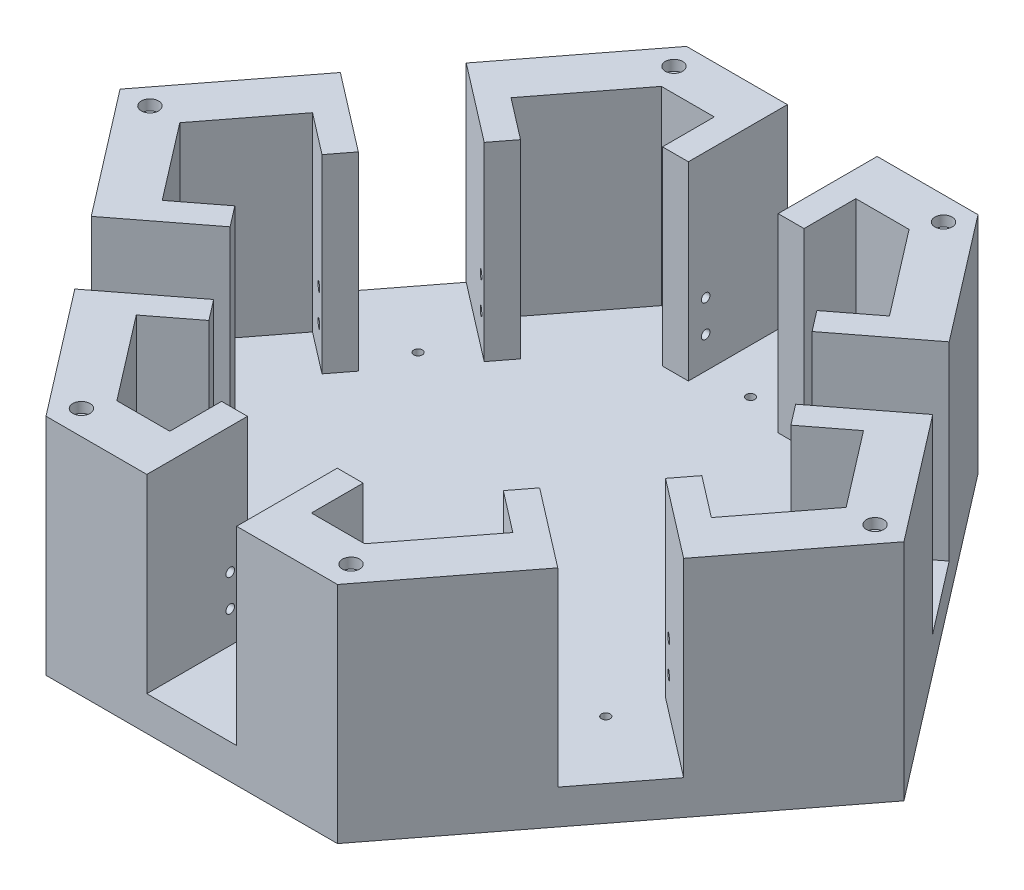
from build123d import *

# Parameters (mm, degrees)
BOSS_EXTRUDE2_DEPTH = 65
CUT_EXTRUDE1_DEPTH  = 55
SKETCH4_W           = 26
SKETCH4_H           = 55
CUT_EXTRUDE2_DEPTH  = 17
SKETCH10_W          = 26
SKETCH10_H          = 55
CUT_EXTRUDE3_DEPTH  = 17
SKETCH9_W           = 26
SKETCH9_H           = 55
CUT_EXTRUDE4_DEPTH  = 17
SKETCH8_W           = 26
SKETCH8_H           = 55
CUT_EXTRUDE5_DEPTH  = 17
SKETCH7_W           = 26
SKETCH7_H           = 55
CUT_EXTRUDE6_DEPTH  = 17
SKETCH6_W           = 26
SKETCH6_H           = 55
CUT_EXTRUDE7_DEPTH  = 17
SKETCH11_W          = 7.5
SKETCH11_H          = 15
BOSS_EXTRUDE4_DEPTH = 55
SKETCH12_R          = 1.25
CUT_EXTRUDE8_DEPTH  = 17
SKETCH13_R          = 1.25
CUT_EXTRUDE9_DEPTH  = 11
CUT_EXTRUDE10_START = -11
SKETCH14_R          = 1.25
CUT_EXTRUDE10_DEPTH = 11
SKETCH15_R          = 1.25
CUT_EXTRUDE11_DEPTH = 43
SKETCH16_R          = 1.25
CUT_EXTRUDE12_DEPTH = 43
SKETCH17_R          = 1.25
CUT_EXTRUDE13_DEPTH = 43
SKETCH18_R          = 1.25
CUT_EXTRUDE14_DEPTH = 43
SKETCH19_R          = 1.25
CUT_EXTRUDE15_DEPTH = 43
SKETCH20_R          = 2.5
CUT_EXTRUDE16_DEPTH = 3


with BuildPart() as part:
    # Sketch1 → Boss-Extrude2 (new body)
    with BuildSketch(Plane(origin=(0, 0, 0), x_dir=(1, 0, 0), z_dir=(0, 1, 0))):
        Polygon((-42.489685364, -94.349995431), (41.923987132, -94.349995431), (113.2396696, -1.586008434), (41.923987132, 91.177978564), (-42.489685364, 91.177978564), (-113.805367831, -1.586008434), align=None)
    extrude(amount=BOSS_EXTRUDE2_DEPTH)

    # Sketch5 → Cut-Extrude1 (cut)
    with BuildSketch(Plane(origin=(0, 65, 0), x_dir=(1, 0, 0), z_dir=(0, 1, 0))):
        Polygon((-96.734562657, -1.348107169), (-36.116232559, 77.501281779), (35.635389063, 77.501281779), (96.25371916, -1.348107169), (35.635389063, -80.197496117), (-36.116232559, -80.197496117), align=None)
    extrude(amount=-CUT_EXTRUDE1_DEPTH, mode=Mode.SUBTRACT)

    # Sketch4 → Cut-Extrude2 (cut)
    with BuildSketch(Plane(origin=(-70.762900796, 0, -54.40154878), x_dir=(-0.6094893586708845, 0, 0.792794249264558), z_dir=(-0.7927942492645579, 0, -0.6094893586708844))):
        with Locations((12.116086518, 37.5)):
            Rectangle(SKETCH4_W, SKETCH4_H)
    extrude(amount=-CUT_EXTRUDE2_DEPTH, mode=Mode.SUBTRACT)

    # Sketch10 → Cut-Extrude3 (cut)
    with BuildSketch(Plane(origin=(-72.295618263, 0, 55.579880973), x_dir=(0.6094893586708846, 0, 0.7927942492645578), z_dir=(-0.7927942492645578, 0, 0.6094893586708846))):
        with Locations((-9.601329787, 37.5)):
            Rectangle(SKETCH10_W, SKETCH10_H)
    extrude(amount=-CUT_EXTRUDE3_DEPTH, mode=Mode.SUBTRACT)

    # Sketch9 → Cut-Extrude4 (cut)
    with BuildSketch(Plane.XY.offset(94.349995431)):
        with Locations((-0.282849116, 37.5)):
            Rectangle(SKETCH9_W, SKETCH9_H)
    extrude(amount=-CUT_EXTRUDE4_DEPTH, mode=Mode.SUBTRACT)

    # Sketch8 → Cut-Extrude5 (cut)
    with BuildSketch(Plane(origin=(71.940064072, 0, 55.306535781), x_dir=(0.6094893586708842, 0, -0.7927942492645581), z_dir=(0.7927942492645581, 0, 0.6094893586708842))):
        with Locations((9.256542735, 37.5)):
            Rectangle(SKETCH8_W, SKETCH8_H)
    extrude(amount=-CUT_EXTRUDE5_DEPTH, mode=Mode.SUBTRACT)

    # Sketch7 → Cut-Extrude6 (cut)
    with BuildSketch(Plane(origin=(70.407346604, 0, -54.128203588), x_dir=(-0.6094893586708847, 0, -0.7927942492645578), z_dir=(0.7927942492645579, 0, -0.6094893586708847))):
        with Locations((-11.771299466, 37.5)):
            Rectangle(SKETCH7_W, SKETCH7_H)
    extrude(amount=-CUT_EXTRUDE6_DEPTH, mode=Mode.SUBTRACT)

    # Sketch6 → Cut-Extrude7 (cut)
    with BuildSketch(Plane(origin=(0, 0, -91.177978564), x_dir=(-1, 0, 0), z_dir=(0, 0, -1))):
        with Locations((0.282849116, 37.5)):
            Rectangle(SKETCH6_W, SKETCH6_H)
    extrude(amount=-CUT_EXTRUDE7_DEPTH, mode=Mode.SUBTRACT)

    # Sketch11 → Boss-Extrude4 (add)
    with BuildSketch(Plane(origin=(0, 10, 0), x_dir=(1, 0, 0), z_dir=(0, 1, 0))):
        with Locations((-17.032849116, -72.697496117)):
            Rectangle(SKETCH11_W, SKETCH11_H)
        with Locations((16.467150884, -72.697496117)):
            Rectangle(SKETCH11_W, SKETCH11_H)
        with Locations((-17.032849116, 70.001281779)):
            Rectangle(SKETCH11_W, SKETCH11_H)
        with Locations((16.467150884, 70.001281779)):
            Rectangle(SKETCH11_W, SKETCH11_H)
        Polygon((-75.226545521, -29.324694546), (-63.334631782, -20.182354166), (-67.905801972, -14.236397297), (-79.797715711, -23.378737677), align=None)
        Polygon((-59.379822195, -49.937345027), (-47.487908456, -40.795004647), (-42.916738266, -46.740961516), (-54.808652005, -55.883301897), align=None)
        Polygon((-75.456453141, 26.329427508), (-63.564539402, 17.187087128), (-68.135709592, 11.241130258), (-80.027623331, 20.383470638), align=None)
        Polygon((-59.609729815, 46.942077989), (-47.717816076, 37.799737608), (-43.146645886, 43.745694478), (-55.038559625, 52.888034858), align=None)
        Polygon((58.867457093, -49.978346806), (46.975543354, -40.836006426), (42.404373164, -46.781963295), (54.296286903, -55.924303675), align=None)
        Polygon((74.714180418, -29.365696325), (62.822266679, -20.223355945), (67.393436869, -14.277399075), (79.285350608, -23.419739455), align=None)
        Polygon((74.944088038, 26.370429286), (63.0521743, 17.228088906), (67.62334449, 11.282132037), (79.515258229, 20.424472417), align=None)
        Polygon((59.097364713, 46.983079767), (47.205450974, 37.840739387), (42.634280784, 43.786696257), (54.526194523, 52.929036637), align=None)
    extrude(amount=BOSS_EXTRUDE4_DEPTH)

    # Sketch12 → Cut-Extrude8 (cut)
    with BuildSketch(Plane(origin=(0, 10, 0), x_dir=(1, 0, 0), z_dir=(0, 1, 0))):
        with Locations(Location((-0.282849116, -70.197496117, 0), (0, 0, 270))):
            Circle(SKETCH12_R)
        with Locations(Location((-59.375241365, -33.5361262, 0), (0, 0, 270))):
            Circle(SKETCH12_R)
        with Locations(Location((-59.605148985, 30.540859161, 0), (0, 0, 270))):
            Circle(SKETCH12_R)
        with Locations(Location((-0.282849116, 67.501281779, 0), (0, 0, 270))):
            Circle(SKETCH12_R)
        with Locations(Location((59.092783883, 30.58186094, 0), (0, 0, 270))):
            Circle(SKETCH12_R)
        with Locations(Location((58.862876263, -33.577127979, 0), (0, 0, 270))):
            Circle(SKETCH12_R)
    extrude(amount=-CUT_EXTRUDE8_DEPTH, mode=Mode.SUBTRACT)

    # Sketch13 → Cut-Extrude9 (cut)
    with BuildSketch(Plane(origin=(-13.282849116, 0, 0), x_dir=(0, 0, -1), z_dir=(1, 0, 0))):
        with Locations((67.501281779, 28.4)):
            Circle(SKETCH13_R)
        with Locations((67.501281779, 19.2)):
            Circle(SKETCH13_R)
    extrude(amount=-CUT_EXTRUDE9_DEPTH, mode=Mode.SUBTRACT)

    # Sketch14 → Cut-Extrude10 (cut)
    with BuildSketch(Plane.ZY.offset(-12.717150884).offset(CUT_EXTRUDE10_START)):
        with Locations(Location((-67.501281779, 19.2, 0), (0, 0, 180))):
            Circle(SKETCH14_R)
        with Locations((-67.501281779, 26.82449259)):
            Circle(SKETCH14_R)
    extrude(amount=CUT_EXTRUDE10_DEPTH, mode=Mode.SUBTRACT)

    # Sketch15 → Cut-Extrude11 (cut)
    with BuildSketch(Plane(origin=(-5.320050091, 0, -6.920063587), x_dir=(-0.7927942492645578, 0, 0.6094893586708846), z_dir=(-0.6094893586708846, 0, -0.7927942492645578))):
        with Locations((-65.487738047, 19.2)):
            Circle(SKETCH15_R)
        with Locations((-65.487738047, 28.4)):
            Circle(SKETCH15_R)
    extrude(amount=-CUT_EXTRUDE11_DEPTH, mode=Mode.SUBTRACT)

    # Sketch16 → Cut-Extrude12 (cut)
    with BuildSketch(Plane(origin=(18.136296148, 0, -23.590815958), x_dir=(-0.7927942492645582, 0, -0.6094893586708842), z_dir=(0.6094893586708842, 0, -0.7927942492645582))):
        with Locations((-67.131051994, 28.4)):
            Circle(SKETCH16_R)
        with Locations((-67.131051994, 19.2)):
            Circle(SKETCH16_R)
    extrude(amount=-CUT_EXTRUDE12_DEPTH, mode=Mode.SUBTRACT)

    # Sketch17 → Cut-Extrude13 (cut)
    with BuildSketch(Plane.ZY.offset(20.782849116)):
        with Locations((70.197496117, 19.2)):
            Circle(SKETCH17_R)
        with Locations((70.197496117, 28.4)):
            Circle(SKETCH17_R)
    extrude(amount=-CUT_EXTRUDE13_DEPTH, mode=Mode.SUBTRACT)

    # Sketch18 → Cut-Extrude14 (cut)
    with BuildSketch(Plane(origin=(6.642623519, 0, 8.64040307), x_dir=(0.7927942492645585, 0, -0.6094893586708838), z_dir=(0.6094893586708837, 0, 0.7927942492645584))):
        with Locations((-67.512261953, 19.2)):
            Circle(SKETCH18_R)
        with Locations((-67.512261953, 28.4)):
            Circle(SKETCH18_R)
    extrude(amount=-CUT_EXTRUDE14_DEPTH, mode=Mode.SUBTRACT)

    # Sketch19 → Cut-Extrude15 (cut)
    with BuildSketch(Plane(origin=(5.109906051, 0, -6.646718395), x_dir=(-0.7927942492645588, 0, -0.6094893586708833), z_dir=(0.6094893586708833, 0, -0.7927942492645588))):
        with Locations((65.868948006, 19.2)):
            Circle(SKETCH19_R)
        with Locations((65.868948006, 28.4)):
            Circle(SKETCH19_R)
    extrude(amount=-CUT_EXTRUDE15_DEPTH, mode=Mode.SUBTRACT)

    # Sketch20 → Cut-Extrude16 (cut)
    with BuildSketch(Plane(origin=(0, 65, 0), x_dir=(1, 0, 0), z_dir=(0, 1, 0))):
        with Locations(Location((104.74669438, -1.467057801, 0), (0, 0, 270))):
            Circle(SKETCH20_R)
        with Locations(Location((38.779688098, 84.339630172, 0), (0, 0, 270))):
            Circle(SKETCH20_R)
        with Locations(Location((-39.302958961, 84.339630172, 0), (0, 0, 270))):
            Circle(SKETCH20_R)
        with Locations(Location((-105.269965244, -1.467057801, 0), (0, 0, 270))):
            Circle(SKETCH20_R)
        with Locations(Location((-39.302958961, -87.273745774, 0), (0, 0, 270))):
            Circle(SKETCH20_R)
        with Locations(Location((38.779688098, -87.273745774, 0), (0, 0, 270))):
            Circle(SKETCH20_R)
    extrude(amount=-CUT_EXTRUDE16_DEPTH, mode=Mode.SUBTRACT)


solid = part.part
